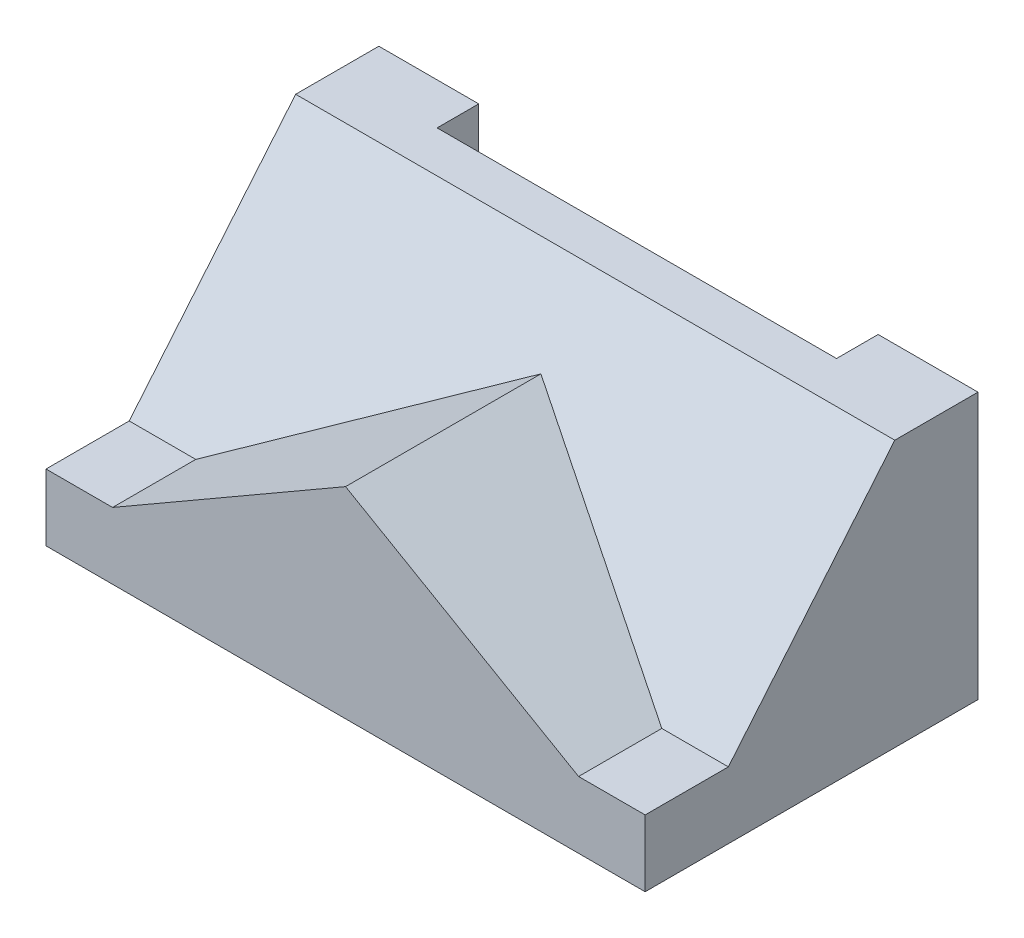
from build123d import *

# Parameters (mm, degrees)
BOSS_EXTRUDE1_DEPTH     = 114.3
CUT_EXTRUDE1_DEPTH      = 130.047249099
CUT_EXTRUDE1_DEPTH_BACK = 130.047249099
SKETCH2_W               = 38.1
SKETCH2_H               = 7.9375
BOSS_EXTRUDE2_REACH     = 142.276


with BuildPart() as part:
    # Sketch1 → Boss-Extrude1 (new body)
    with BuildSketch(Plane(origin=(0, 0, 0), x_dir=(0, 0, -1), z_dir=(1, 0, 0))):
        Polygon((-31.75, 0), (31.75, 0), (31.75, 50.8), (15.875, 50.8), (-15.875, 12.7), (-31.75, 12.7), align=None)
    extrude(amount=-BOSS_EXTRUDE1_DEPTH)

    # Sketch2 → Cut-Extrude1 (cut, two sides: drawn at the far end of the back side and taken through both)
    with BuildSketch(Plane(origin=(0, 50.8, 0), x_dir=(1, 0, 0), z_dir=(0, 1, 0)).offset(-CUT_EXTRUDE1_DEPTH_BACK)):
        with Locations((-76.2, 27.78125)):
            Rectangle(SKETCH2_W, SKETCH2_H)
        with Locations((-38.1, 27.78125)):
            Rectangle(SKETCH2_W, SKETCH2_H)
    extrude(amount=CUT_EXTRUDE1_DEPTH + CUT_EXTRUDE1_DEPTH_BACK, mode=Mode.SUBTRACT)

    # Boss-Extrude2: up to this plane
    boss_extrude2_end = Plane(origin=(-114.3, 50.8, -15.875), z_dir=(0, 0.6401843996644797, 0.768221279597376))
    # Sketch10 → Boss-Extrude2 (add, up to the surface)
    with BuildSketch(Plane.XY.offset(31.75), mode=Mode.PRIVATE) as boss_extrude2_sk1:
        Polygon((-57.15, 38.363219465), (-101.6, 12.7), (-57.15, 12.7), align=None)
    boss_extrude2_tool1 = split(extrude(boss_extrude2_sk1.sketch, amount=-BOSS_EXTRUDE2_REACH, mode=Mode.PRIVATE), bisect_by=boss_extrude2_end, keep=Keep.BOTH, mode=Mode.PRIVATE)
    add(boss_extrude2_tool1.solids().sort_by_distance((-71.966667, 21.254406, 31.75))[0])
    # Sketch10 → Boss-Extrude2 (add, up to the surface)
    with BuildSketch(Plane.XY.offset(31.75), mode=Mode.PRIVATE) as boss_extrude2_sk2:
        Polygon((-57.15, 38.363219465), (-57.15, 12.7), (-12.7, 12.7), align=None)
    boss_extrude2_tool2 = split(extrude(boss_extrude2_sk2.sketch, amount=-BOSS_EXTRUDE2_REACH, mode=Mode.PRIVATE), bisect_by=boss_extrude2_end, keep=Keep.BOTH, mode=Mode.PRIVATE)
    add(boss_extrude2_tool2.solids().sort_by_distance((-42.333333, 21.254406, 31.75))[0])


solid = part.part
